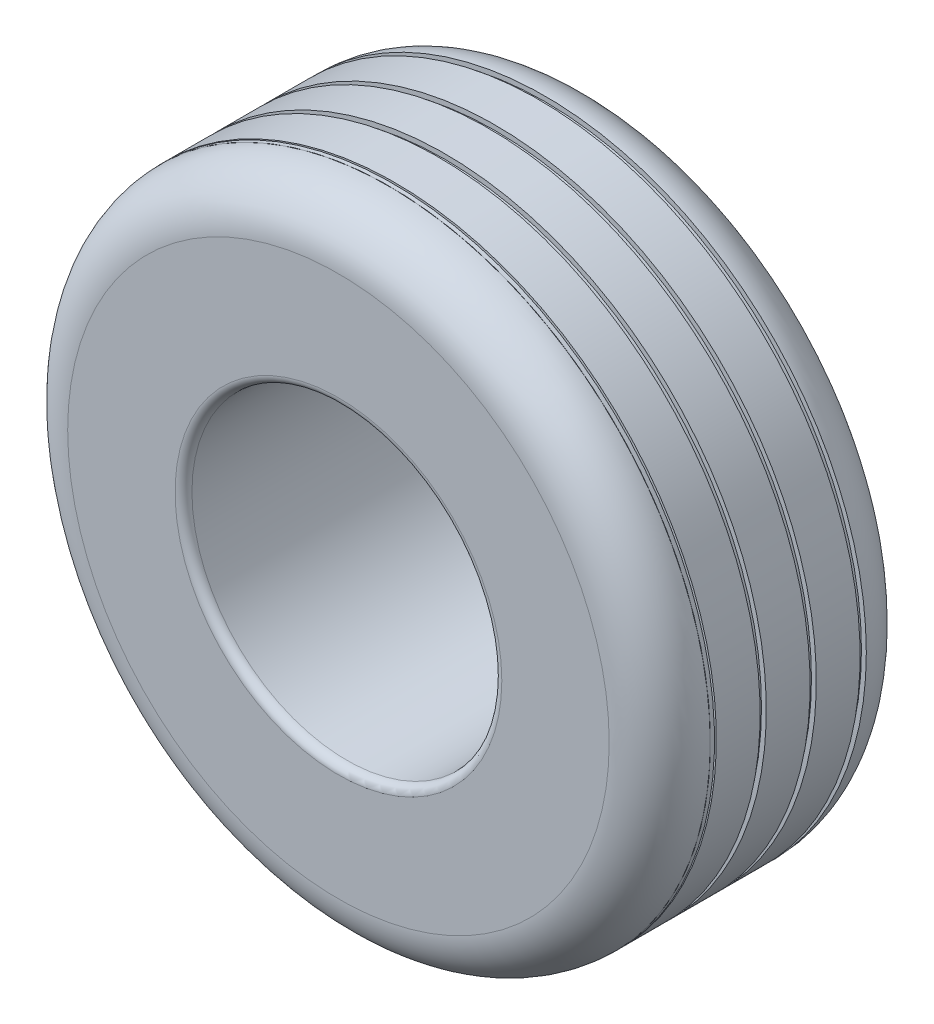
from build123d import *

# Parameters (mm, degrees)
SKETCH1_R           = 190.5
BOSS_EXTRUDE2_DEPTH = 152.4
SKETCH2_R           = 91.846152722
CUT_EXTRUDE1_DEPTH  = 310.525863217
FILLET6_R           = 30
FILLET7_R           = 5
FILLET8_R           = 30
FILLET9_R           = 5
SKETCH15_W          = 3.664018236
SKETCH15_H          = 9.251646897
LPATTERN1_COUNT     = 4
LPATTERN1_PITCH     = 29.63
SKETCH12_W          = 2.426218227
SKETCH12_H          = 2.248959897


with BuildPart() as part:
    # Sketch1 → Boss-Extrude2 (new body)
    with BuildSketch(Plane.XY):
        with Locations(Location((0, 0, 0), (0, 0, 180))):
            Circle(SKETCH1_R)
    extrude(amount=BOSS_EXTRUDE2_DEPTH)

    # Sketch2 → Cut-Extrude1 (cut, through all)
    with BuildSketch(Plane.XY.offset(152.4)):
        Circle(SKETCH2_R)
    extrude(amount=-CUT_EXTRUDE1_DEPTH, mode=Mode.SUBTRACT)

    # Fillet6
    fillet6_edges = [part.edges().sort_by_distance(p)[0] for p in [
        (190.5, 0, 152.4),
    ]]
    fillet(fillet6_edges, radius=FILLET6_R)

    # Fillet7
    fillet7_edges = [part.edges().sort_by_distance(p)[0] for p in [
        (-91.846152722, 0, 152.4),
    ]]
    fillet(fillet7_edges, radius=FILLET7_R)

    # Fillet8
    fillet8_edges = [part.edges().sort_by_distance(p)[0] for p in [
        (190.5, 0, 0),
    ]]
    fillet(fillet8_edges, radius=FILLET8_R)

    # Fillet9
    fillet9_edges = [part.edges().sort_by_distance(p)[0] for p in [
        (-91.846152722, 0, 0),
    ]]
    fillet(fillet9_edges, radius=FILLET9_R)

    # Sketch15 → Cut-Revolve2 (revolve, cut)
    with BuildSketch(Plane(origin=(0, 0, 0), x_dir=(0, 0, -1), z_dir=(1, 0, 0)), mode=Mode.PRIVATE) as cut_revolve2_sk:
        with Locations((-120.711161531, 192.240026696)):
            Rectangle(SKETCH15_W, SKETCH15_H)
    cut_revolve2 = revolve(cut_revolve2_sk.sketch.rotate(Axis((0, 0, 0), (0, 0, 1)), 90), axis=Axis((0, 0, 0), (0, 0, 1)), mode=Mode.SUBTRACT)

    # LPattern1: Cut-Revolve2 ×4
    with Locations(*[(0, 0, -i * LPATTERN1_PITCH) for i in range(1, LPATTERN1_COUNT)]):
        add(cut_revolve2, mode=Mode.SUBTRACT)

    # Sketch16 → Cut-Revolve3 (revolve, cut)
    with BuildSketch(Plane(origin=(0, 0, 0), x_dir=(1, 0, 0), z_dir=(0, 1, 0)), mode=Mode.PRIVATE) as cut_revolve3_sk:
        Polygon((-180.729174932, -9.645191629), (-168.926256906, -9.645191629), (-168.926256906, -1.711599117), (-99.07711791, -1.711599117), (-99.07711791, -9.645191629), (-94.252430553, -9.645191629), (-94.252430553, -141.627079393), (-99.07711791, -141.627079393), (-99.07711791, -149.560671905), (-168.926256906, -149.560671905), (-168.926256906, -141.627079393), (-180.729174932, -141.627079393), (-180.729174932, -129.764804653), (-185.970080603, -129.764804653), (-185.970080603, -19.963686479), (-180.729174932, -19.963686479), align=None)
    revolve(cut_revolve3_sk.sketch.rotate(Axis((0, 0, 118.879152413), (0, 0, -1)), 180), axis=Axis((0, 0, 118.879152413), (0, 0, -1)), mode=Mode.SUBTRACT)


with BuildPart() as body_2:
    # Sketch12 → Revolve6 (revolve)
    with BuildSketch(Plane(origin=(0, 0, 0), x_dir=(0, 0, -1), z_dir=(1, 0, 0)), mode=Mode.PRIVATE) as revolve6_sk:
        with Locations((-121.186890887, 189.375520052)):
            Rectangle(SKETCH12_W, SKETCH12_H)
    revolve(revolve6_sk.sketch.rotate(Axis((0, 0, 0), (0, 0, 1)), 90), axis=Axis((0, 0, 0), (0, 0, 1)))


solid = Compound([part.part, body_2.part])
